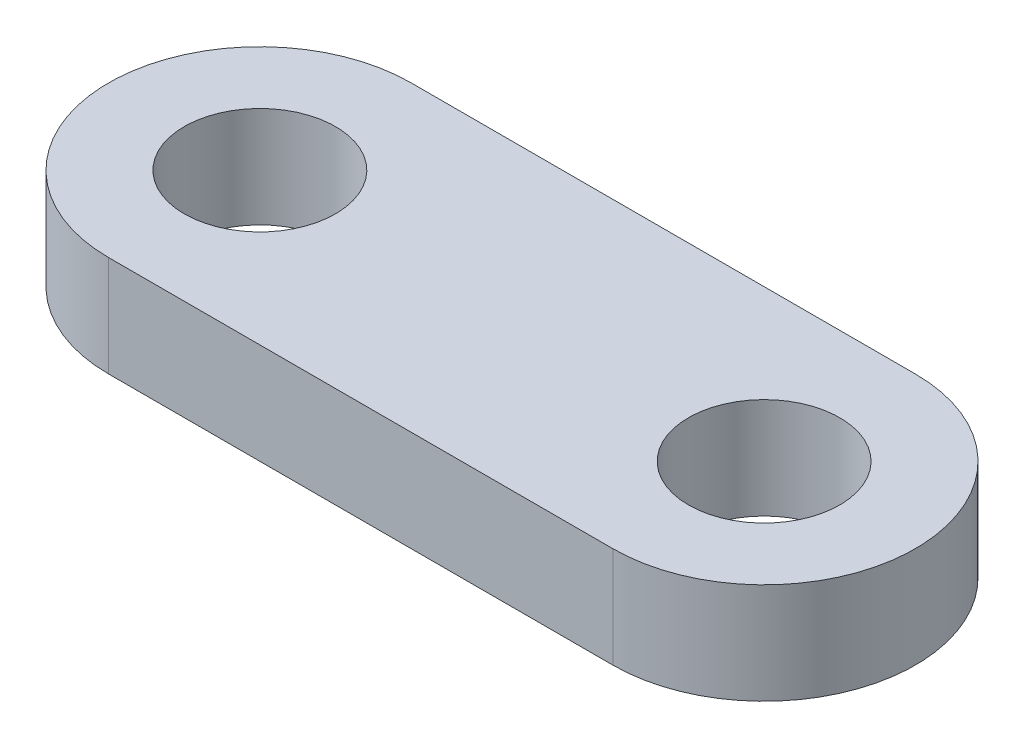
from build123d import *

# Parameters (mm, degrees)
SKETCH_1_R      = 1.5
EXTRUDE_1_DEPTH = 1


with BuildPart() as part:
    # 草图1 → 凸台-拉伸1 (new, symmetric)
    with BuildSketch(Plane(origin=(0, 0, 0), x_dir=(1, 0, 0), z_dir=(0, 1, 0))):
        with BuildLine():
            Line((-5, 3), (5, 3))
            ThreePointArc((5, 3), (8, 0), (5, -3))
            Line((5, -3), (-5, -3))
            ThreePointArc((-5, -3), (-8, 0), (-5, 3))
        make_face()
        with Locations(Location((-5, 0, 0), (0, 0, 270))):
            Circle(SKETCH_1_R, mode=Mode.SUBTRACT)
        with Locations(Location((5, 0, 0), (0, 0, 270))):
            Circle(SKETCH_1_R, mode=Mode.SUBTRACT)
    extrude(amount=EXTRUDE_1_DEPTH, both=True)


solid = part.part
